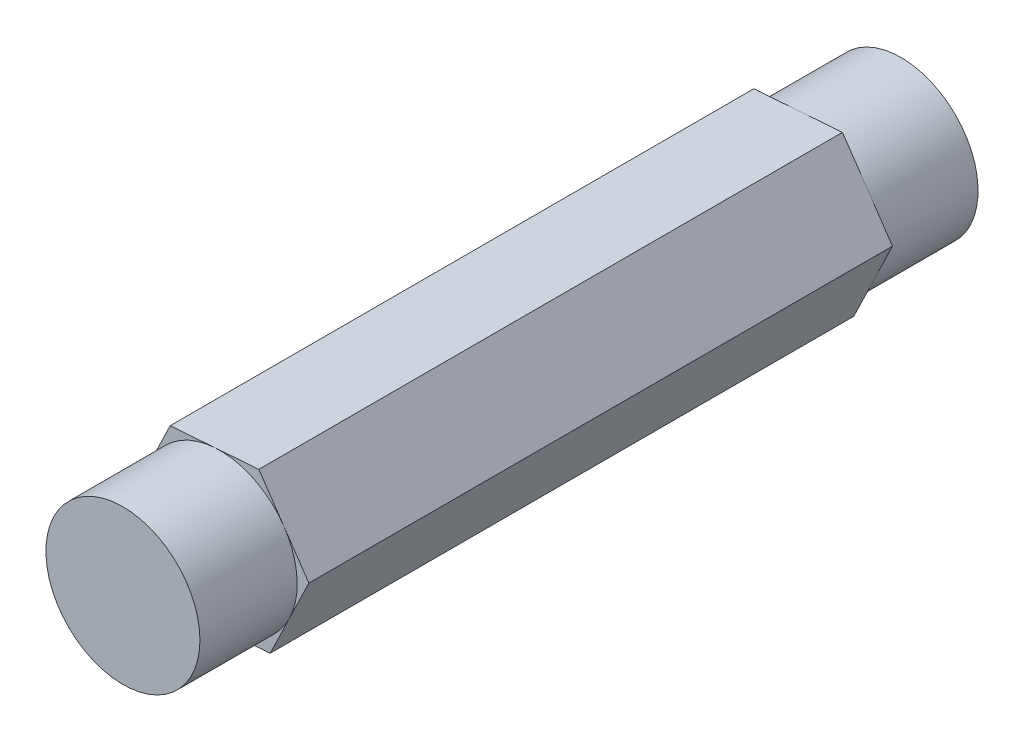
from build123d import *

# Parameters (mm, degrees)
EXTRUDE_1_DEPTH = 36
SKETCH_4_R      = 4.75
EXTRUDE_2_DEPTH = 6
EXTRUDE_START   = 6
SKETCH_5_R      = 4.75
EXTRUDE_3_DEPTH = 6


with BuildPart() as part:
    # 草图3 → 凸台-拉伸1 (new body)
    with BuildSketch(Plane.XY):
        Polygon((5.469832359, 0.405299024), (2.383916929, 4.939663289), (-3.08591543, 4.534364265), (-5.469832359, -0.405299024), (-2.383916929, -4.939663289), (3.08591543, -4.534364265), align=None)
    extrude(amount=EXTRUDE_1_DEPTH)

    # 草图4 → 凸台-拉伸2 (add)
    with BuildSketch(Plane(origin=(0, 0, 0), x_dir=(-1, 0, 0), z_dir=(0, 0, -1))):
        with Locations(Location((0, 0, 0), (0, 0, 205.7622899))):
            Circle(SKETCH_4_R)
    extrude(amount=EXTRUDE_2_DEPTH)

    # 草图5 → 凸台-拉伸3 (add)
    with BuildSketch(Plane.XY.offset(36).offset(EXTRUDE_START)):
        with Locations(Location((0, 0, 0), (0, 0, 334.2377101))):
            Circle(SKETCH_5_R)
    extrude(amount=-EXTRUDE_3_DEPTH)


solid = part.part
